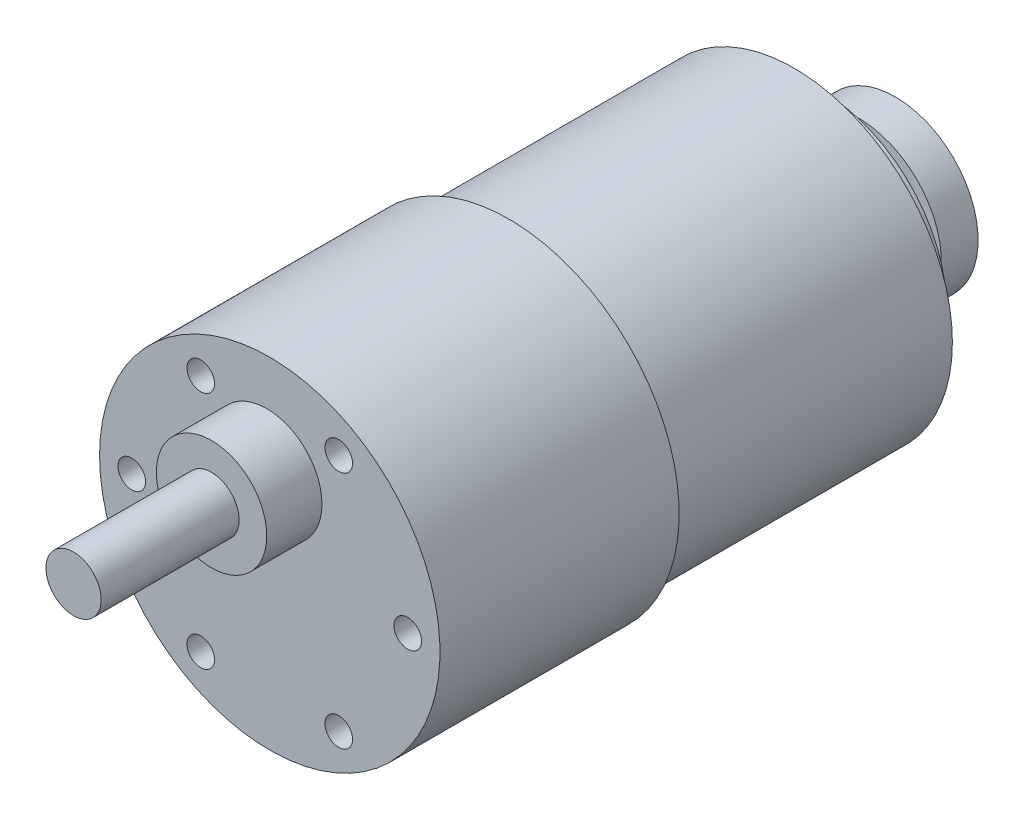
from build123d import *

# Parameters (mm, degrees)
ESQUISSE1_R             = 18.5
BOSS_EXTRU_1_DEPTH      = 26
ESQUISSE2_R             = 17.2
BOSS_EXTRU_2_DEPTH      = 31
ESQUISSE3_R             = 13.55
BOSS_EXTRU_3_DEPTH      = 3
ESQUISSE4_R             = 0.75
BOSS_EXTRU_4_DEPTH      = 4
ESQUISSE5_R             = 9
BOSS_EXTRU_5_DEPTH      = 4
ESQUISSE6_R             = 6
BOSS_EXTRU_7_DEPTH      = 6
ESQUISSE8_R             = 3
BOSS_EXTRU_8_DEPTH      = 15
ESQUISSE9_R             = 1.5
ENL_V_MAT_EXTRU_4_DEPTH = 5


with BuildPart() as part:
    # Esquisse1 → Boss.-Extru.1 (new body)
    with BuildSketch(Plane.XY):
        with Locations(Location((0, 0, 0), (0, 0, 180))):
            Circle(ESQUISSE1_R)
    extrude(amount=BOSS_EXTRU_1_DEPTH)

    # Esquisse2 → Boss.-Extru.2 (add)
    with BuildSketch(Plane(origin=(0, 0, 0), x_dir=(-1, 0, 0), z_dir=(0, 0, -1))):
        with Locations(Location((0, 0, 0), (0, 0, 180))):
            Circle(ESQUISSE2_R)
    extrude(amount=BOSS_EXTRU_2_DEPTH)

    # Esquisse3 → Boss.-Extru.3 (add)
    with BuildSketch(Plane(origin=(0, 0, -31), x_dir=(-1, 0, 0), z_dir=(0, 0, -1))):
        Circle(ESQUISSE3_R)
    extrude(amount=BOSS_EXTRU_3_DEPTH)

    # Esquisse4 → Boss.-Extru.4 (add)
    with BuildSketch(Plane(origin=(0, 0, -34), x_dir=(-1, 0, 0), z_dir=(0, 0, -1))):
        Circle(ESQUISSE4_R)
    extrude(amount=BOSS_EXTRU_4_DEPTH)

    # Esquisse5 → Boss.-Extru.5 (add)
    with BuildSketch(Plane(origin=(0, 0, -38), x_dir=(-1, 0, 0), z_dir=(0, 0, -1))):
        Circle(ESQUISSE5_R)
    extrude(amount=BOSS_EXTRU_5_DEPTH)

    # Esquisse6 → Boss.-Extru.7 (add)
    with BuildSketch(Plane.XY.offset(26)):
        with Locations((-0.326961586, 7.492869685)):
            Circle(ESQUISSE6_R)
    extrude(amount=BOSS_EXTRU_7_DEPTH)

    # Esquisse8 → Boss.-Extru.8 (add)
    with BuildSketch(Plane.XY.offset(32)):
        with Locations((-0.326961586, 7.492869685)):
            Circle(ESQUISSE8_R)
    extrude(amount=BOSS_EXTRU_8_DEPTH)

    # Esquisse9 → Enlèv. mat.-Extru.4 (cut)
    with BuildSketch(Plane.XY.offset(26)):
        with Locations((15, 0)):
            Circle(ESQUISSE9_R)
        with Locations((7.5, -12.990381057)):
            Circle(ESQUISSE9_R)
        with Locations((-7.5, -12.990381057)):
            Circle(ESQUISSE9_R)
        with Locations((-15, 0)):
            Circle(ESQUISSE9_R)
        with Locations((-7.5, 12.990381057)):
            Circle(ESQUISSE9_R)
        with Locations((7.5, 12.990381057)):
            Circle(ESQUISSE9_R)
    extrude(amount=-ENL_V_MAT_EXTRU_4_DEPTH, mode=Mode.SUBTRACT)


solid = part.part
